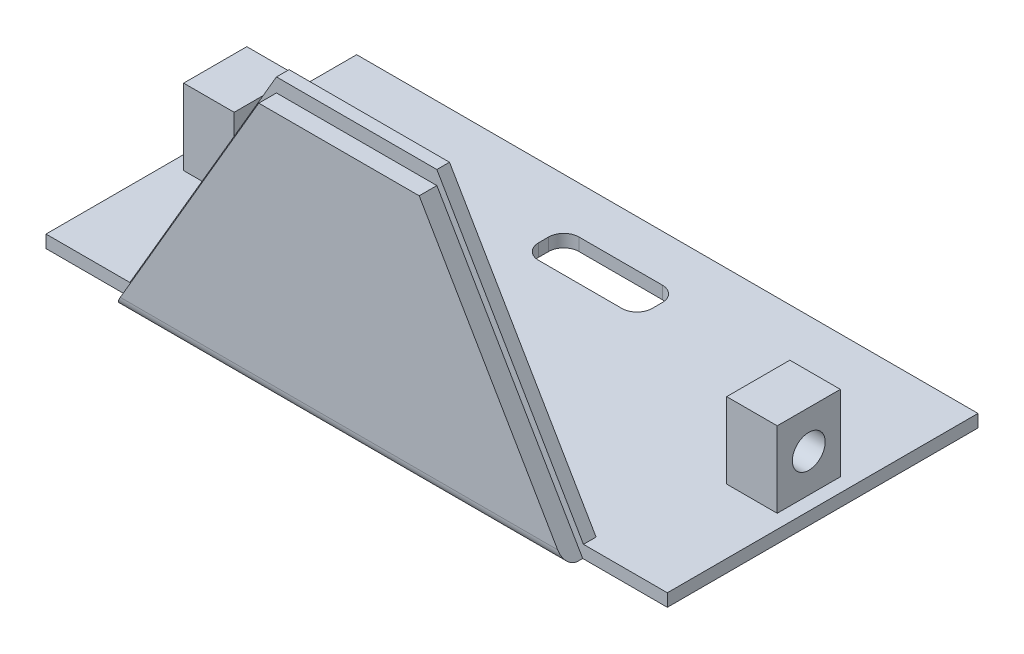
from build123d import *

# Parameters (mm, degrees)
SKIZZE1_W                       = 49.2
SKIZZE1_H                       = 24.6
AUFSATZ_LINEAR_AUSTRAGEN1_DEPTH = 1
AUFSATZ_LINEAR_AUSTRAGEN2_DEPTH = 1.4
AUFSATZ_LINEAR_AUSTRAGEN3_DEPTH = 1
AUFSATZ_LINEAR_AUSTRAGEN4_DEPTH = 0.5
SKIZZE6_W                       = 4
SKIZZE6_H                       = 5
AUFSATZ_LINEAR_AUSTRAGEN5_DEPTH = 6
SKIZZE7_R                       = 1.3
SCHNITT_LINEAR_AUSTRAGEN1_DEPTH = 4
VERRUNDUNG1_R                   = 1
SCHNITT_LINEAR_AUSTRAGEN2_DEPTH = 1


with BuildPart() as part:
    # Skizze1 → Aufsatz-Linear austragen1 (new body)
    with BuildSketch(Plane(origin=(0, 0, 0), x_dir=(1, 0, 0), z_dir=(0, 1, 0))):
        Rectangle(SKIZZE1_W, SKIZZE1_H)
    extrude(amount=AUFSATZ_LINEAR_AUSTRAGEN1_DEPTH)

    # Skizze2 → Aufsatz-Linear austragen2 (add)
    with BuildSketch(Plane.XY.offset(12.3)):
        Polygon((17.9, 0), (-17.9, 0), (-6.35, 19.8), (6.35, 19.8), align=None)
    extrude(amount=AUFSATZ_LINEAR_AUSTRAGEN2_DEPTH)

    # Skizze4 → Aufsatz-Linear austragen3 (add)
    with BuildSketch(Plane(origin=(0, 0, 12.3), x_dir=(-1, 0, 0), z_dir=(0, 0, -1))):
        Polygon((6.35, 20.9), (17.958333333, 1), (-17.958333333, 1), (-6.35, 20.9), align=None)
    extrude(amount=AUFSATZ_LINEAR_AUSTRAGEN3_DEPTH)

    # Skizze5 → Aufsatz-Linear austragen4 (add, symmetric)
    with BuildSketch(Plane(origin=(5, 0, 0), x_dir=(0, 0, -1), z_dir=(1, 0, 0))):
        Polygon((-6.3, 1), (-11.3, 15.9), (-11.3, 1), align=None)
    aufsatz_linear_austragen4 = extrude(amount=AUFSATZ_LINEAR_AUSTRAGEN4_DEPTH, both=True)

    # Spiegeln1: Aufsatz-Linear austragen4 across plane
    add(aufsatz_linear_austragen4.mirror(Plane(origin=(0, 0, 0), x_dir=(0, 0, 1), z_dir=(1, 0, 0))))

    # Skizze6 → Aufsatz-Linear austragen5 (add)
    with BuildSketch(Plane(origin=(0, 1, 0), x_dir=(1, 0, 0), z_dir=(0, 1, 0))):
        with Locations((-21.5, 0)):
            Rectangle(SKIZZE6_W, SKIZZE6_H)
    aufsatz_linear_austragen5 = extrude(amount=AUFSATZ_LINEAR_AUSTRAGEN5_DEPTH)

    # Skizze7 → Schnitt-Linear austragen1 (cut)
    with BuildSketch(Plane.ZY.offset(23.5)):
        with Locations((0, 4)):
            Circle(SKIZZE7_R)
    schnitt_linear_austragen1 = extrude(amount=-SCHNITT_LINEAR_AUSTRAGEN1_DEPTH, mode=Mode.SUBTRACT)

    # Spiegeln2: Aufsatz-Linear austragen5, Schnitt-Linear austragen1 across plane
    add(aufsatz_linear_austragen5.mirror(Plane(origin=(0, 0, 0), x_dir=(0, 0, 1), z_dir=(1, 0, 0))))
    add(schnitt_linear_austragen1.mirror(Plane(origin=(0, 0, 0), x_dir=(0, 0, 1), z_dir=(1, 0, 0))), mode=Mode.SUBTRACT)

    # Verrundung1
    verrundung1_edges = [part.edges().sort_by_distance(p)[0] for p in [
        (0, 0, 13.7),
    ]]
    fillet(verrundung1_edges, radius=VERRUNDUNG1_R)

    # Skizze8 → Schnitt-Linear austragen2 (cut)
    with BuildSketch(Plane.XZ):
        with BuildLine():
            Line((3.3, -5.4), (-3.3, -5.4))
            ThreePointArc((-3.3, -5.4), (-4.148528137, -5.751471863), (-4.5, -6.6))
            Line((-4.5, -6.6), (-4.5, -7.4))
            ThreePointArc((-4.5, -7.4), (-4.148528137, -8.248528137), (-3.3, -8.6))
            Line((-3.3, -8.6), (3.3, -8.6))
            ThreePointArc((3.3, -8.6), (4.148528137, -8.248528137), (4.5, -7.4))
            Line((4.5, -7.4), (4.5, -6.6))
            ThreePointArc((4.5, -6.6), (4.148528137, -5.751471863), (3.3, -5.4))
        make_face()
    extrude(amount=-SCHNITT_LINEAR_AUSTRAGEN2_DEPTH, mode=Mode.SUBTRACT)


solid = part.part
